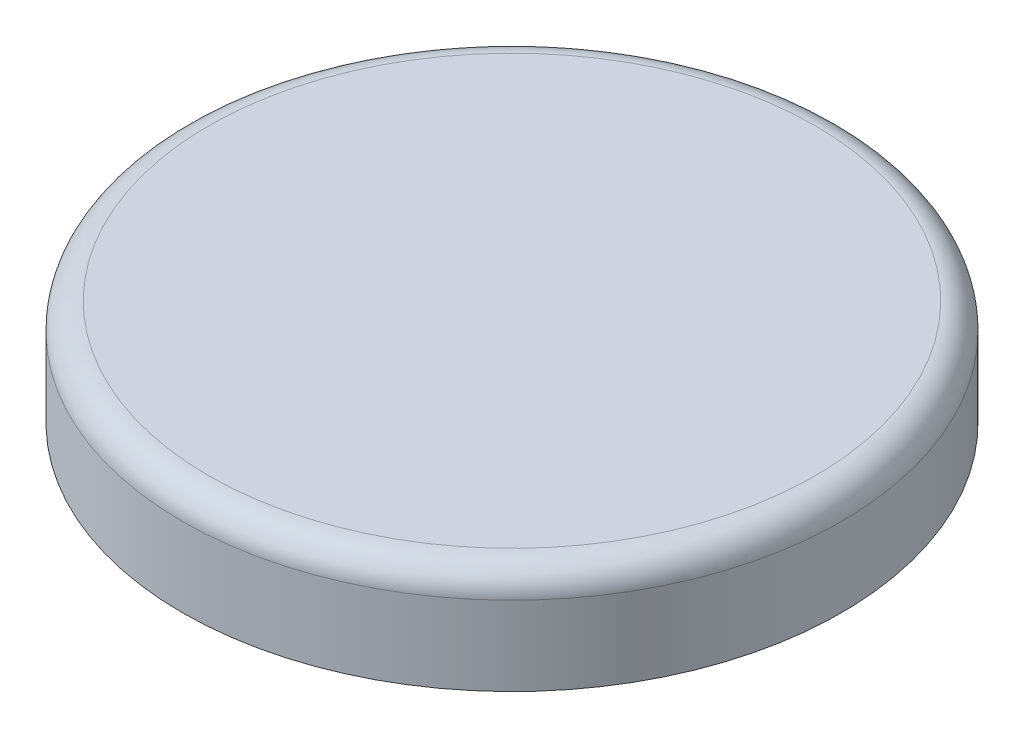
from build123d import *

# Parameters (mm, degrees)
CROQUIS1_R              = 125
SALIENTE_EXTRUIR1_DEPTH = 40
CROQUIS2_R              = 100
CORTAR_EXTRUIR1_DEPTH   = 30
REDONDEO1_R             = 10


with BuildPart() as part:
    # Croquis1 → Saliente-Extruir1 (new body)
    with BuildSketch(Plane(origin=(0, 0, 0), x_dir=(1, 0, 0), z_dir=(0, 1, 0))):
        with Locations(Location((0, 0, 0), (0, 0, 270))):
            Circle(CROQUIS1_R)
    extrude(amount=SALIENTE_EXTRUIR1_DEPTH)

    # Croquis2 → Cortar-Extruir1 (cut)
    with BuildSketch(Plane.XZ):
        with Locations(Location((0, 0, 0), (0, 0, 270))):
            Circle(CROQUIS2_R)
    extrude(amount=-CORTAR_EXTRUIR1_DEPTH, mode=Mode.SUBTRACT)

    # Redondeo1
    redondeo1_edges = [part.edges().sort_by_distance(p)[0] for p in [
        (0, 40, -125),
    ]]
    fillet(redondeo1_edges, radius=REDONDEO1_R)


solid = part.part
